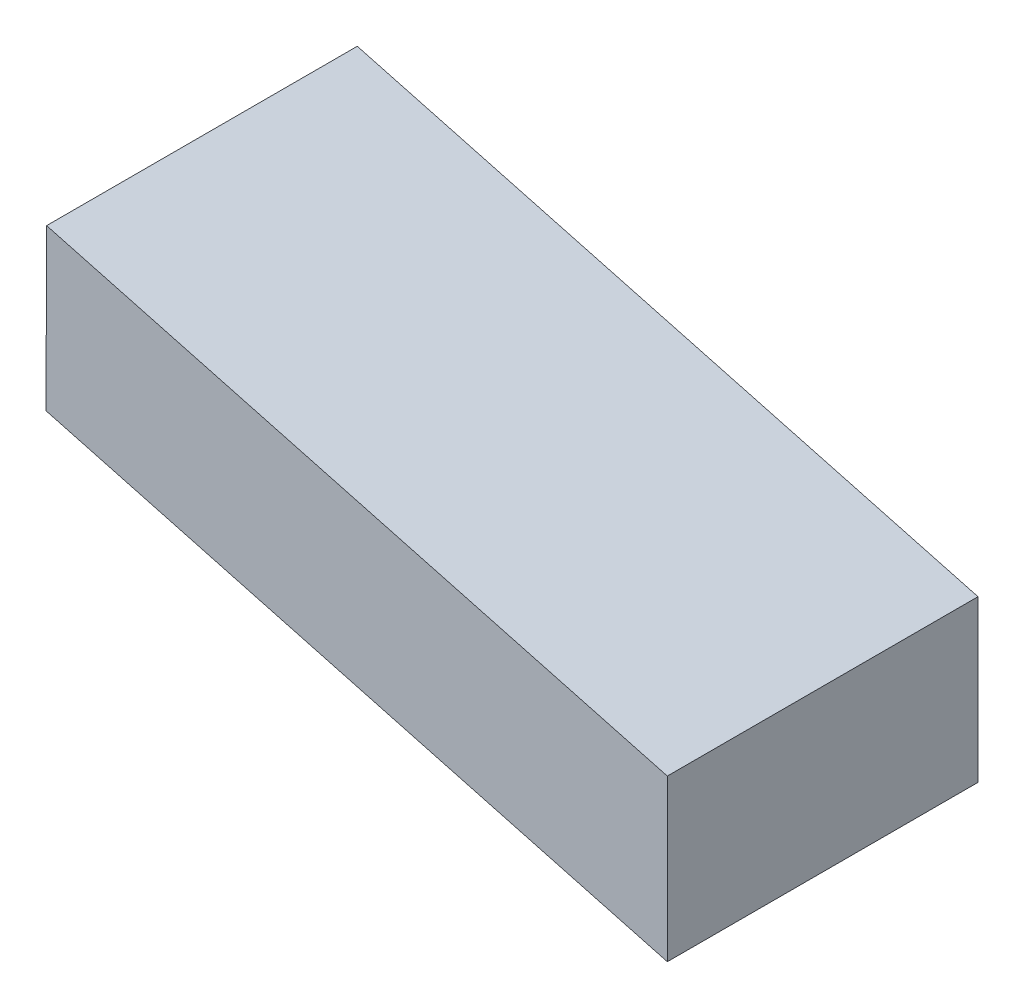
from build123d import *

# Parameters (mm, degrees)
EXTRUDE_1_DEPTH = 10


with BuildPart() as part:
    # Эскиз1 → Бобышка-Вытянуть1 (new body)
    with BuildSketch(Plane.XY):
        Polygon((0, 0), (0, 5.176380902), (-19.980326746, 10.530093318), (-20, 5.358983849), align=None)
    extrude(amount=-EXTRUDE_1_DEPTH)


solid = part.part
